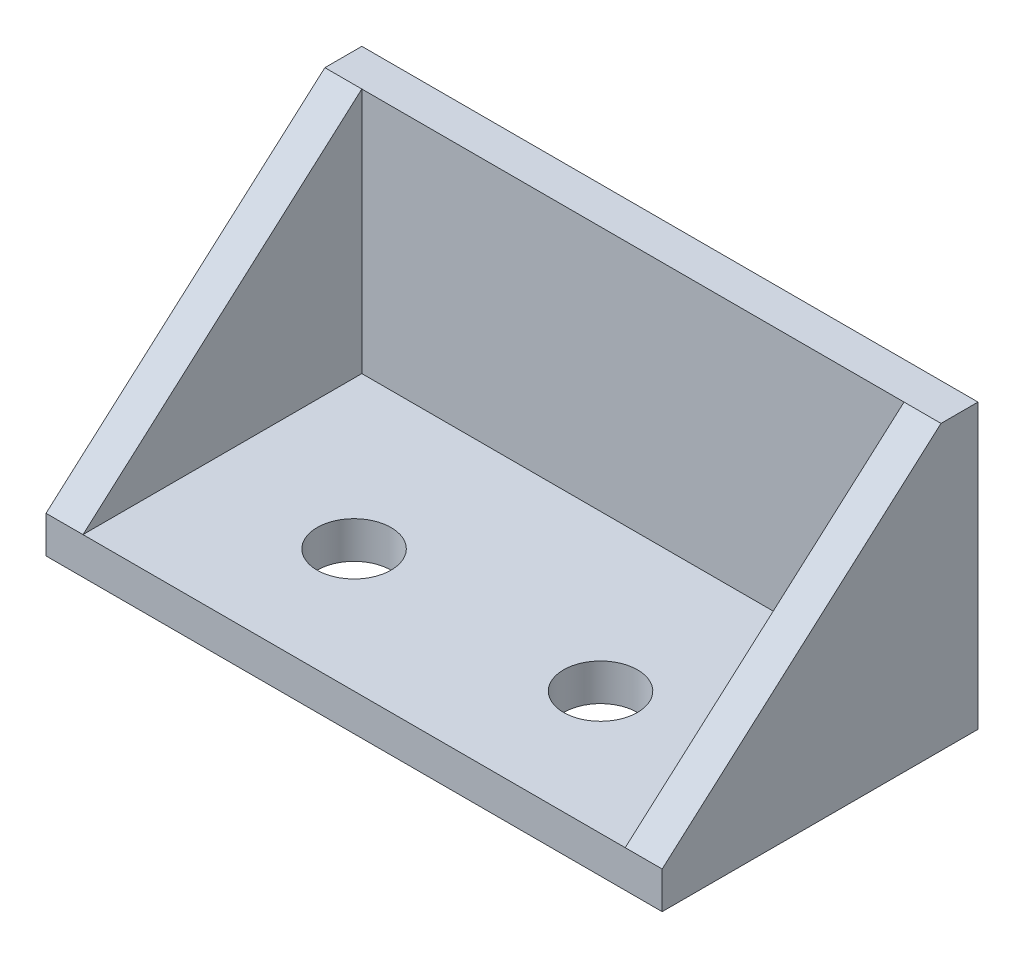
from build123d import *

# Parameters (mm, degrees)
SKETCH_1_W          = 50
SKETCH_1_H          = 25.63
EXTRUDE_1_DEPTH     = 3
SKETCH_2_W          = 50
SKETCH_2_H          = 3
EXTRUDE_2_DEPTH     = 20
EXTRUDE_3_DEPTH     = 3
SKETCH_7_R          = 3
CUT_EXTRUDE_2_DEPTH = 38.749172176


with BuildPart() as part:
    # 草圖1 → 填料-伸長1 (new body)
    with BuildSketch(Plane(origin=(0, 0, 0), x_dir=(1, 0, 0), z_dir=(0, 1, 0))):
        with Locations((0, -7.185)):
            Rectangle(SKETCH_1_W, SKETCH_1_H)
    extrude(amount=EXTRUDE_1_DEPTH)

    # 草圖2 → 填料-伸長2 (add)
    with BuildSketch(Plane(origin=(0, 3, 0), x_dir=(1, 0, 0), z_dir=(0, 1, 0))):
        with Locations((0, 4.13)):
            Rectangle(SKETCH_2_W, SKETCH_2_H)
    extrude(amount=EXTRUDE_2_DEPTH)

    # 草圖6 → 填料-伸長3 (add)
    with BuildSketch(Plane.ZY.offset(25)):
        Polygon((-2.63, 23), (20, 3), (-2.63, 3), align=None)
    extrude_3 = extrude(amount=-EXTRUDE_3_DEPTH)

    # 鏡射1: 填料-伸長3 across plane
    add(extrude_3.mirror(Plane(origin=(0, 0, 0), x_dir=(0, 0, 1), z_dir=(1, 0, 0))))

    # 草圖7 → 除料-伸長2 (cut, through all)
    with BuildSketch(Plane(origin=(0, 3, 0), x_dir=(1, 0, 0), z_dir=(0, 1, 0))):
        with Locations(Location((-10, -10, 0), (0, 0, 270))):
            Circle(SKETCH_7_R)
        with Locations(Location((10, -10, 0), (0, 0, 90))):
            Circle(SKETCH_7_R)
    extrude(amount=-CUT_EXTRUDE_2_DEPTH, mode=Mode.SUBTRACT)


solid = part.part
